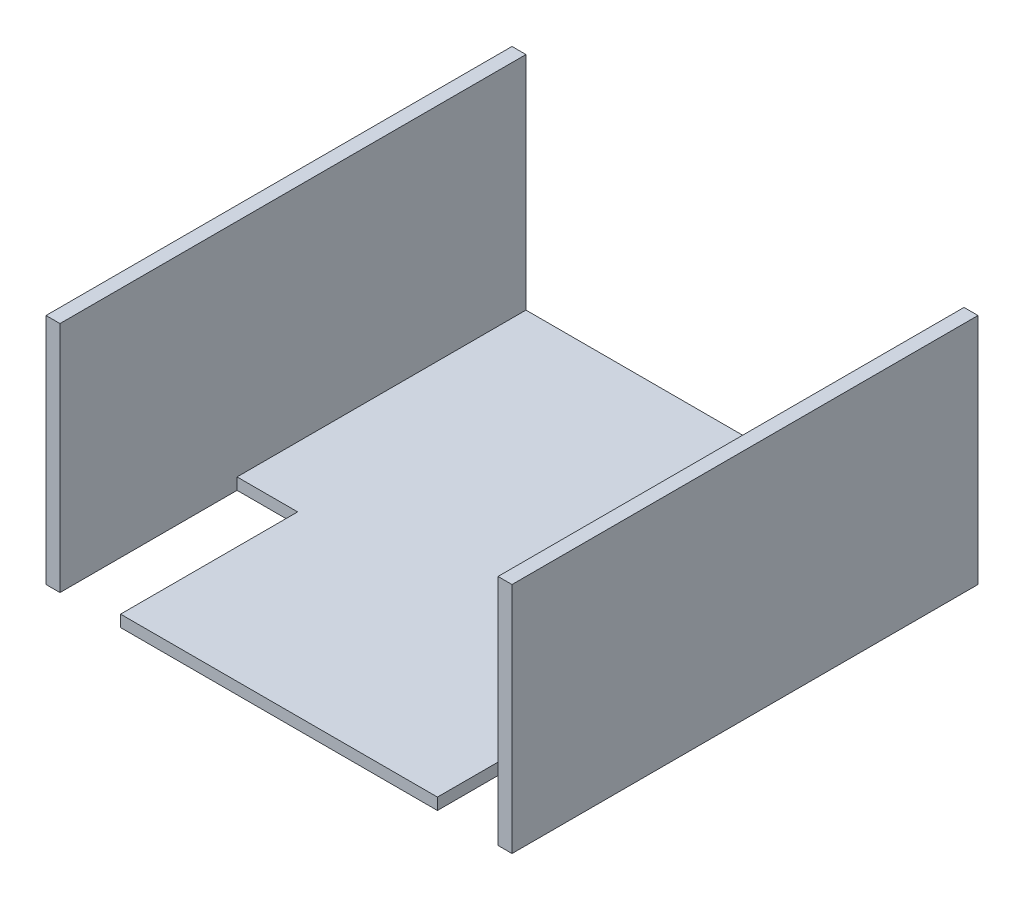
from build123d import *

# Parameters (mm, degrees)
SALIENTE_EXTRUIR1_DEPTH = 100
CROQUIS2_W              = 13
CROQUIS2_H              = 38
CORTAR_EXTRUIR2_DEPTH   = 10


with BuildPart() as part:
    # Croquis1 → Saliente-Extruir1 (new body)
    with BuildSketch(Plane.XY):
        Polygon((50, 0), (-50, 0), (-50, 50), (-47, 50), (-47, 2.5), (47, 2.5), (47, 50), (50, 50), align=None)
    extrude(amount=-SALIENTE_EXTRUIR1_DEPTH)

    # Croquis2 → Cortar-Extruir2 (cut)
    with BuildSketch(Plane(origin=(0, 2.5, 0), x_dir=(1, 0, 0), z_dir=(0, 1, 0))):
        with Locations((-40.5, 19)):
            Rectangle(CROQUIS2_W, CROQUIS2_H)
        with Locations((40.5, 19)):
            Rectangle(CROQUIS2_W, CROQUIS2_H)
    extrude(amount=-CORTAR_EXTRUIR2_DEPTH, mode=Mode.SUBTRACT)


solid = part.part
